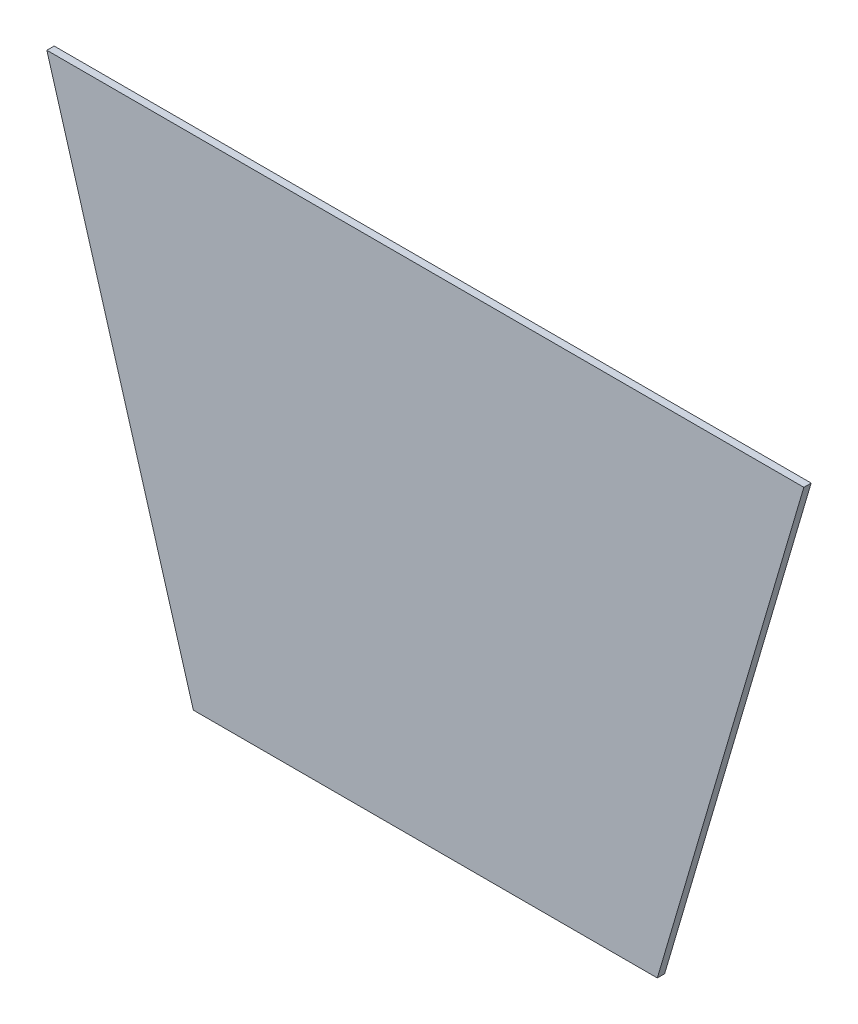
from build123d import *

# Parameters (mm, degrees)
BOSS_EXTRUDE1_DEPTH = 3.175


with BuildPart() as part:
    # Sketch1 → Boss-Extrude1 (new body)
    with BuildSketch(Plane.XY):
        Polygon((-164.0205, 0), (164.0205, 0), (100.5205, -215.9), (-100.5205, -215.9), align=None)
    extrude(amount=-BOSS_EXTRUDE1_DEPTH)


solid = part.part
